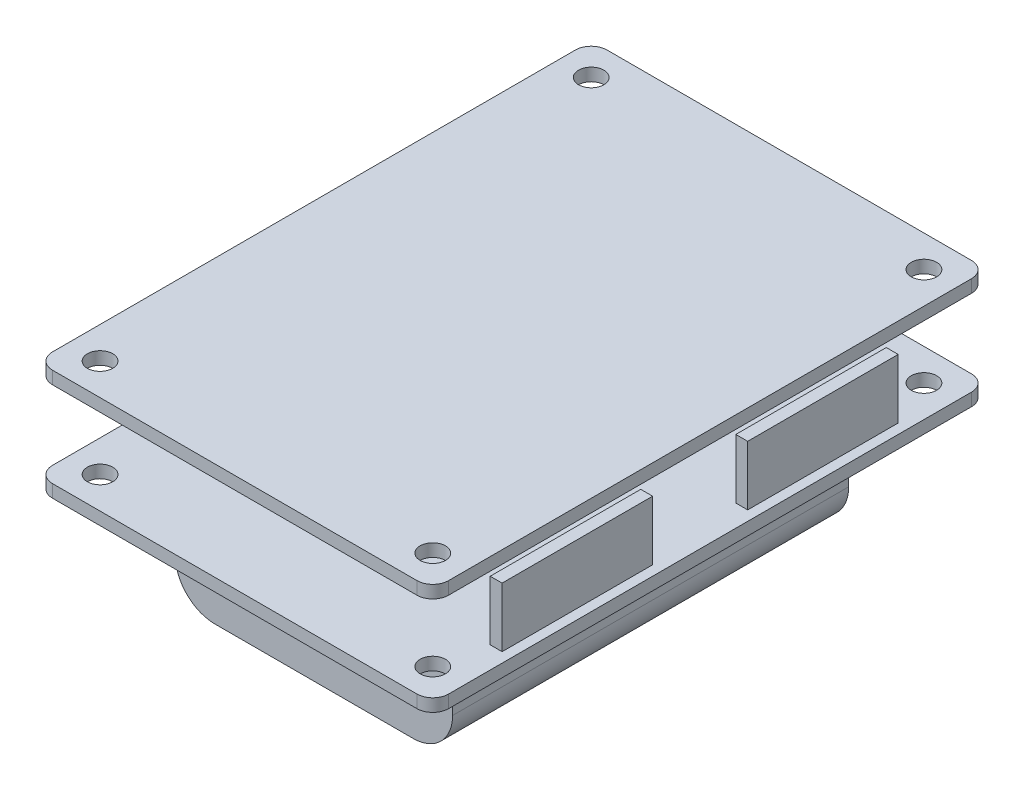
from build123d import *

# Parameters (mm, degrees)
SKETCH1_W                  = 50
SKETCH1_H                  = 70
SKETCH1_R                  = 1.6
BOSS_EXTRUDE1_DEPTH        = 0.8
GPS_START                  = 11.6
SKETCH1_3_W                = 50
SKETCH1_3_H                = 70
SKETCH1_3_R                = 1.6
GPS_EXTENSION_MODULE_DEPTH = 1.6
SKETCH2_W                  = 1.5
SKETCH2_H                  = 19
HEADERS_DEPTH              = 7.5
SKETCH3_W                  = 35
SKETCH3_H                  = 50
BATTERIES_DEPTH            = 13.5
FILLET1_R                  = 2
FILLET2_R                  = 5
FILLET3_R                  = 2


with BuildPart() as part:
    # Sketch1 → Boss-Extrude1 (new, symmetric)
    with BuildSketch(Plane(origin=(0, 0, 0), x_dir=(1, 0, 0), z_dir=(0, 1, 0))):
        Rectangle(SKETCH1_W, SKETCH1_H)
        with Locations((-21, 31)):
            Circle(SKETCH1_R, mode=Mode.SUBTRACT)
        with Locations((21, 31)):
            Circle(SKETCH1_R, mode=Mode.SUBTRACT)
        with Locations((-21, -31)):
            Circle(SKETCH1_R, mode=Mode.SUBTRACT)
        with Locations((21, -31)):
            Circle(SKETCH1_R, mode=Mode.SUBTRACT)
    extrude(amount=BOSS_EXTRUDE1_DEPTH, both=True)

    # Sketch2 → Headers (add)
    with BuildSketch(Plane(origin=(0, 0.8, 0), x_dir=(1, 0, 0), z_dir=(0, 1, 0))):
        with Locations((23, 15.5)):
            Rectangle(SKETCH2_W, SKETCH2_H)
        with Locations((23, -15.5)):
            Rectangle(SKETCH2_W, SKETCH2_H)
    extrude(amount=HEADERS_DEPTH)

    # Sketch3 → Batteries (add)
    with BuildSketch(Plane.XZ.offset(0.8)):
        Rectangle(SKETCH3_W, SKETCH3_H)
    extrude(amount=BATTERIES_DEPTH)

    # Fillet1
    fillet1_edges = [part.edges().sort_by_distance(p)[0] for p in [
        (-25, 0, -35),
        (25, 0, -35),
        (25, 0, 35),
        (-25, 0, 35),
    ]]
    fillet(fillet1_edges, radius=FILLET1_R)

    # Fillet2
    fillet2_edges = [part.edges().sort_by_distance(p)[0] for p in [
        (-17.5, -14.3, 0),
        (17.5, -14.3, 0),
    ]]
    fillet(fillet2_edges, radius=FILLET2_R)


with BuildPart() as body_2:
    # Sketch1<3> → GPS extension Module (new body)
    with BuildSketch(Plane(origin=(0, 0, 0), x_dir=(1, 0, 0), z_dir=(0, 1, 0)).offset(GPS_START)):
        Rectangle(SKETCH1_3_W, SKETCH1_3_H)
        with Locations((-21, 31)):
            Circle(SKETCH1_3_R, mode=Mode.SUBTRACT)
        with Locations((21, 31)):
            Circle(SKETCH1_3_R, mode=Mode.SUBTRACT)
        with Locations((-21, -31)):
            Circle(SKETCH1_3_R, mode=Mode.SUBTRACT)
        with Locations((21, -31)):
            Circle(SKETCH1_3_R, mode=Mode.SUBTRACT)
    extrude(amount=GPS_EXTENSION_MODULE_DEPTH)

    # Fillet3
    fillet3_edges = [body_2.edges().sort_by_distance(p)[0] for p in [
        (-25, 12.4, -35),
        (25, 12.4, -35),
        (25, 12.4, 35),
        (-25, 12.4, 35),
    ]]
    fillet(fillet3_edges, radius=FILLET3_R)


solid = Compound([part.part, body_2.part])
